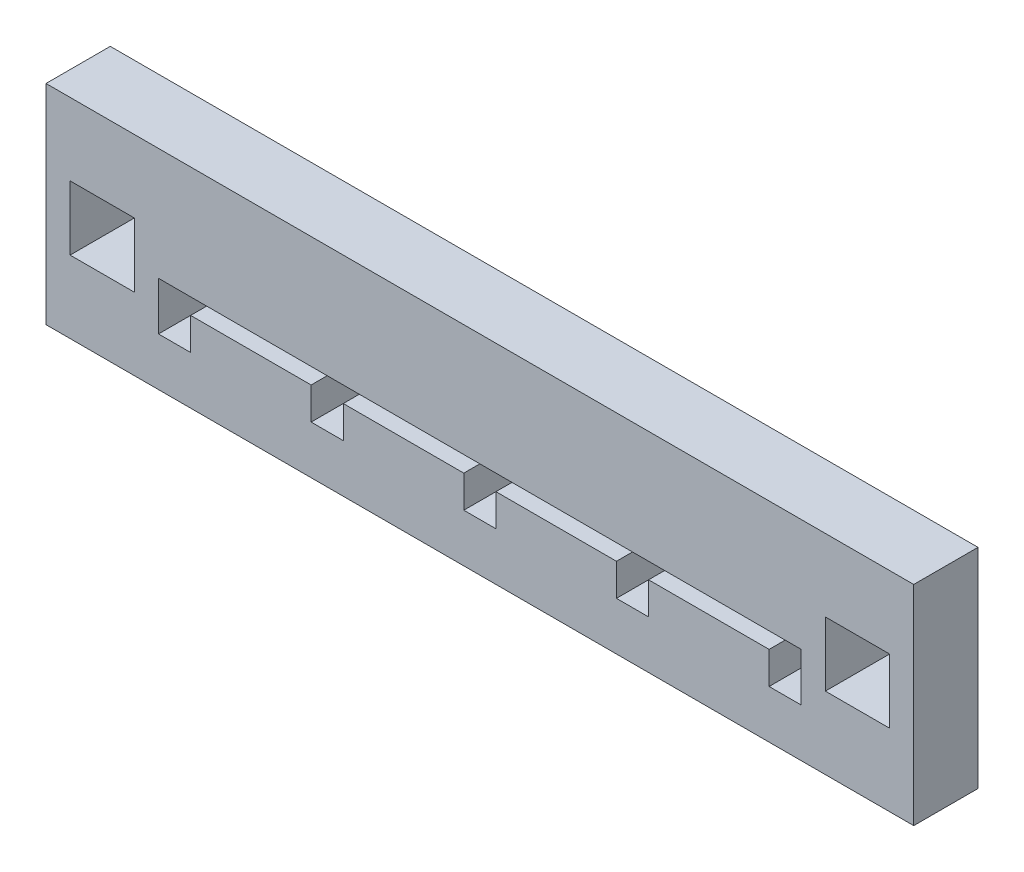
from build123d import *

# Parameters (mm, degrees)
SKETCH1_W           = 54
SKETCH1_H           = 13
SKETCH1_W_2         = 4
SKETCH1_H_2         = 4
BOSS_EXTRUDE1_DEPTH = 4


with BuildPart() as part:
    # Sketch1 → Boss-Extrude1 (new body)
    with BuildSketch(Plane.XY):
        with Locations((27, 6.5)):
            Rectangle(SKETCH1_W, SKETCH1_H)
        Polygon((7, 3), (7, 6), (47, 6), (47, 3), (45, 3), (45, 5), (37.5, 5), (37.5, 3), (35.5, 3), (35.5, 5), (28, 5), (28, 3), (26, 3), (26, 5), (18.5, 5), (18.5, 3), (16.5, 3), (16.5, 5), (9, 5), (9, 3), align=None, mode=Mode.SUBTRACT)
        with Locations((50.5, 6.5)):
            Rectangle(SKETCH1_W_2, SKETCH1_H_2, mode=Mode.SUBTRACT)
        with Locations((3.5, 6.5)):
            Rectangle(SKETCH1_W_2, SKETCH1_H_2, mode=Mode.SUBTRACT)
    extrude(amount=BOSS_EXTRUDE1_DEPTH)


solid = part.part
